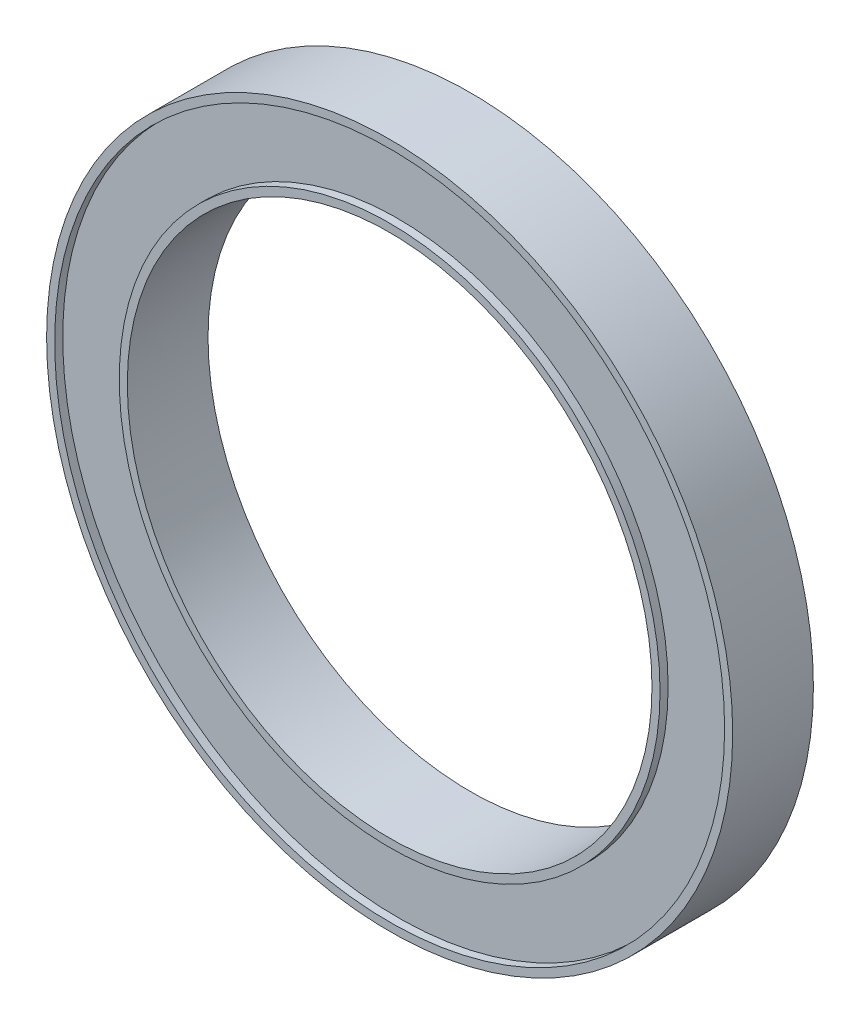
from build123d import *

# Parameters (mm, degrees)
SKETCH1_R           = 42.5
SKETCH1_R_2         = 32.5
BOSS_EXTRUDE1_DEPTH = 5
SKETCH2_R           = 41.5
SKETCH2_R_2         = 33.5
CUT_EXTRUDE1_DEPTH  = 1


with BuildPart() as part:
    # Sketch1 → Boss-Extrude1 (new, symmetric)
    with BuildSketch(Plane.XY):
        Circle(SKETCH1_R)
        Circle(SKETCH1_R_2, mode=Mode.SUBTRACT)
    extrude(amount=BOSS_EXTRUDE1_DEPTH, both=True)

    # Sketch2 → Cut-Extrude1 (cut)
    with BuildSketch(Plane.XY.offset(5)):
        Circle(SKETCH2_R)
        Circle(SKETCH2_R_2, mode=Mode.SUBTRACT)
    cut_extrude1 = extrude(amount=-CUT_EXTRUDE1_DEPTH, mode=Mode.SUBTRACT)

    # Mirror1: Cut-Extrude1 across plane
    add(cut_extrude1.mirror(Plane.XY), mode=Mode.SUBTRACT)


solid = part.part
